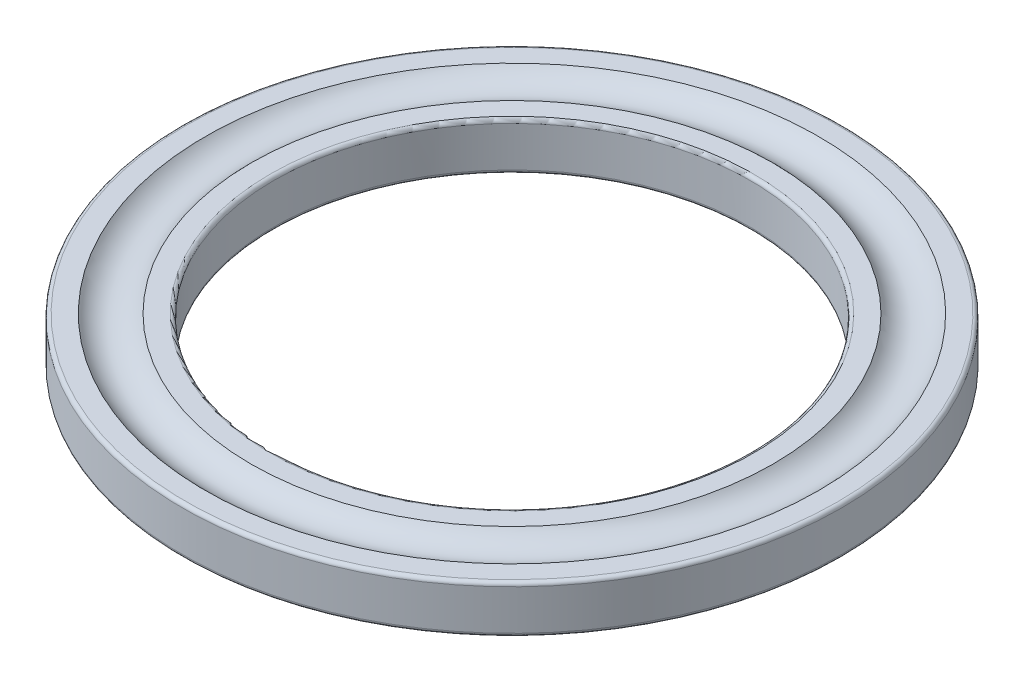
from build123d import *

# Parameters (mm, degrees)
FILLET1_R = 0.5


with BuildPart() as part:
    # Sketch1 → Revolve1 (revolve)
    with BuildSketch(Plane.XY):
        with BuildLine():
            Line((32.5, 0), (45, 0))
            Line((45, 0), (45, 6.5))
            Line((45, 6.5), (41.872498999, 6.5))
            ThreePointArc((41.872498999, 6.5), (38.75, 5), (35.627501001, 6.5))
            Line((35.627501001, 6.5), (32.5, 6.5))
            Line((32.5, 6.5), (32.5, 0))
        make_face()
    revolve(axis=Axis((0, 0, 0), (0, 1, 0)))

    # Fillet1
    fillet1_edges = [part.edges().sort_by_distance(p)[0] for p in [
        (-32.5, 6.5, 0),
        (-45, 6.5, 0),
        (-45, 0, 0),
        (-32.5, 0, 0),
    ]]
    fillet(fillet1_edges, radius=FILLET1_R)


solid = part.part
